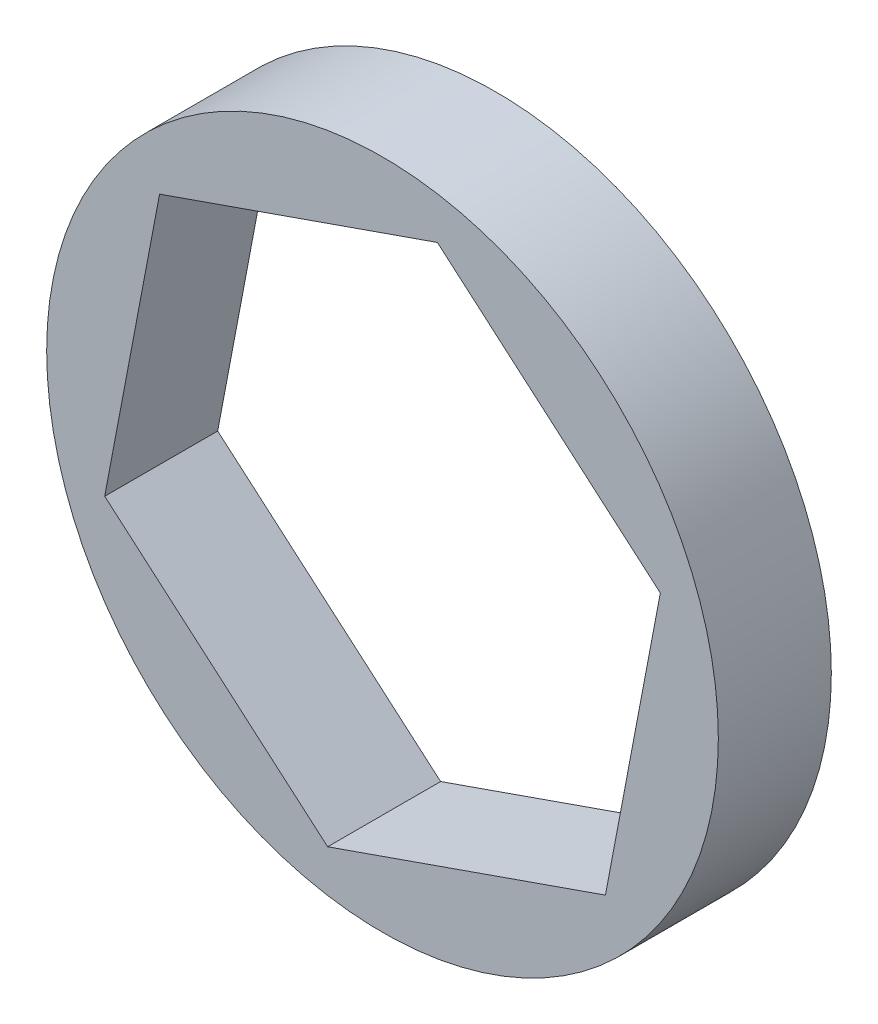
from build123d import *

# Parameters (mm, degrees)
SKETCH1_R           = 8.5
BOSS_EXTRUDE1_DEPTH = 2.86


with BuildPart() as part:
    # Sketch1 → Boss-Extrude1 (new body)
    with BuildSketch(Plane.XY):
        Circle(SKETCH1_R)
        Polygon((-5.642532047, 4.861258379), (-7.031239274, -2.455946905), (-1.388707227, -7.317205284), (5.642532047, -4.861258379), (7.031239274, 2.455946905), (1.388707227, 7.317205284), align=None, mode=Mode.SUBTRACT)
    extrude(amount=BOSS_EXTRUDE1_DEPTH)


solid = part.part
